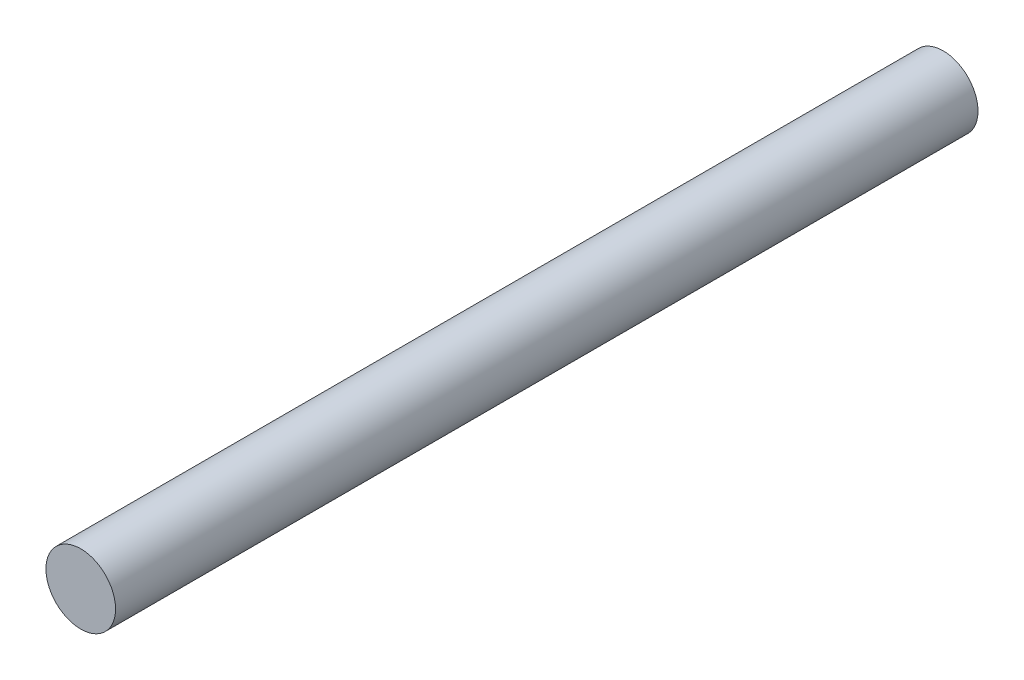
from build123d import *

# Parameters (mm, degrees)
SKETCH1_R           = 11.3
BOSS_EXTRUDE1_DEPTH = 280


with BuildPart() as part:
    # Sketch1 → Boss-Extrude1 (new body)
    with BuildSketch(Plane.XY):
        Circle(SKETCH1_R)
    extrude(amount=BOSS_EXTRUDE1_DEPTH)


solid = part.part
